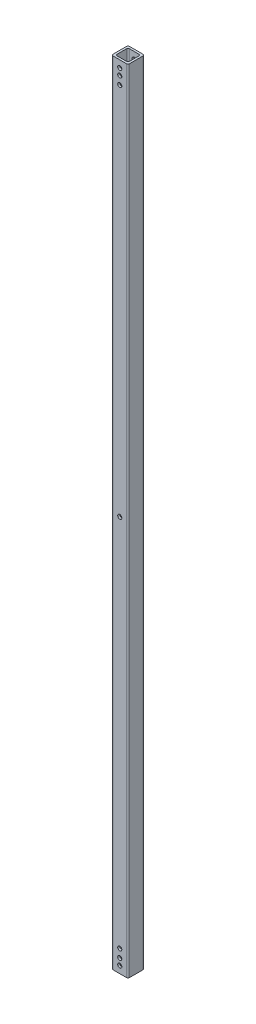
from build123d import *

# Parameters (mm, degrees)
SKETCH1_W           = 25.4
SKETCH1_H           = 25.4
SKETCH1_W_2         = 19.05
SKETCH1_H_2         = 19.05
BOSS_EXTRUDE1_DEPTH = 609.6
FILLET1_R           = 2.1082
SKETCH6_R           = 3.175
CUT_EXTRUDE5_DEPTH  = 611.261099858
SKETCH7_R           = 3.175
CUT_EXTRUDE6_DEPTH  = 611.261099858


with BuildPart() as part:
    # Sketch1 → Boss-Extrude1 (new, symmetric)
    with BuildSketch(Plane(origin=(0, 0, 0), x_dir=(1, 0, 0), z_dir=(0, 1, 0))):
        Rectangle(SKETCH1_W, SKETCH1_H)
        Rectangle(SKETCH1_W_2, SKETCH1_H_2, mode=Mode.SUBTRACT)
    extrude(amount=BOSS_EXTRUDE1_DEPTH, both=True)

    # Fillet1
    fillet1_edges = [part.edges().sort_by_distance(p)[0] for p in [
        (9.525, 0, 9.525),
        (9.525, 0, -9.525),
        (-9.525, 0, -9.525),
        (-9.525, 0, 9.525),
        (-12.7, 0, -12.7),
        (12.7, 0, -12.7),
        (12.7, 0, 12.7),
        (-12.7, 0, 12.7),
    ]]
    fillet(fillet1_edges, radius=FILLET1_R)

    # Sketch6 → Cut-Extrude5 (cut, through all)
    with BuildSketch(Plane(origin=(0, 0, -12.7), x_dir=(-1, 0, 0), z_dir=(0, 0, -1))):
        with Locations((0, -598.805)):
            Circle(SKETCH6_R)
        with Locations((0, -588.645)):
            Circle(SKETCH6_R)
        with Locations((0, -575.945)):
            Circle(SKETCH6_R)
        with Locations((0, 598.805)):
            Circle(SKETCH6_R)
        with Locations((0, 588.645)):
            Circle(SKETCH6_R)
        with Locations((0, 575.945)):
            Circle(SKETCH6_R)
    extrude(amount=-CUT_EXTRUDE5_DEPTH, mode=Mode.SUBTRACT)

    # Sketch7 → Cut-Extrude6 (cut, through all)
    with BuildSketch(Plane(origin=(0, 0, -12.7), x_dir=(-1, 0, 0), z_dir=(0, 0, -1))):
        Circle(SKETCH7_R)
    extrude(amount=-CUT_EXTRUDE6_DEPTH, mode=Mode.SUBTRACT)


solid = part.part
